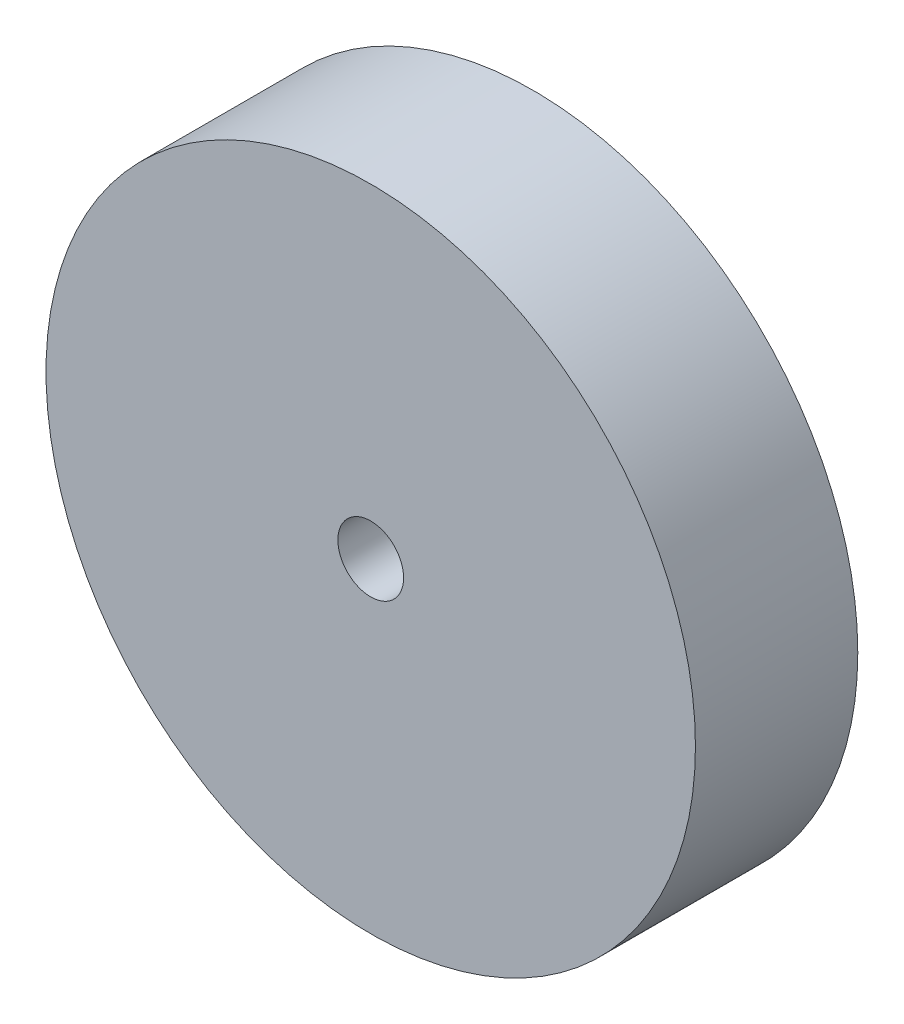
from build123d import *

# Parameters (mm, degrees)
CROQUIS1_R                 = 40
SALIENTE_EXTRUIR1_DEPTH    = 10
CORTAR_EXTRUIR1_DEPTH      = 25
CORTAR_EXTRUIR1_DEPTH_BACK = 56
CROQUIS2_R                 = 4.05


with BuildPart() as part:
    # Croquis1 → Saliente-Extruir1 (new, symmetric)
    with BuildSketch(Plane.XY):
        Circle(CROQUIS1_R)
    extrude(amount=SALIENTE_EXTRUIR1_DEPTH, both=True)

    # Croquis2 → Cortar-Extruir1 (cut, two sides: drawn at the far end of the back side and taken through both)
    with BuildSketch(Plane.XY.offset(10).offset(-CORTAR_EXTRUIR1_DEPTH_BACK)):
        Circle(CROQUIS2_R)
    extrude(amount=CORTAR_EXTRUIR1_DEPTH + CORTAR_EXTRUIR1_DEPTH_BACK, mode=Mode.SUBTRACT)


solid = part.part
